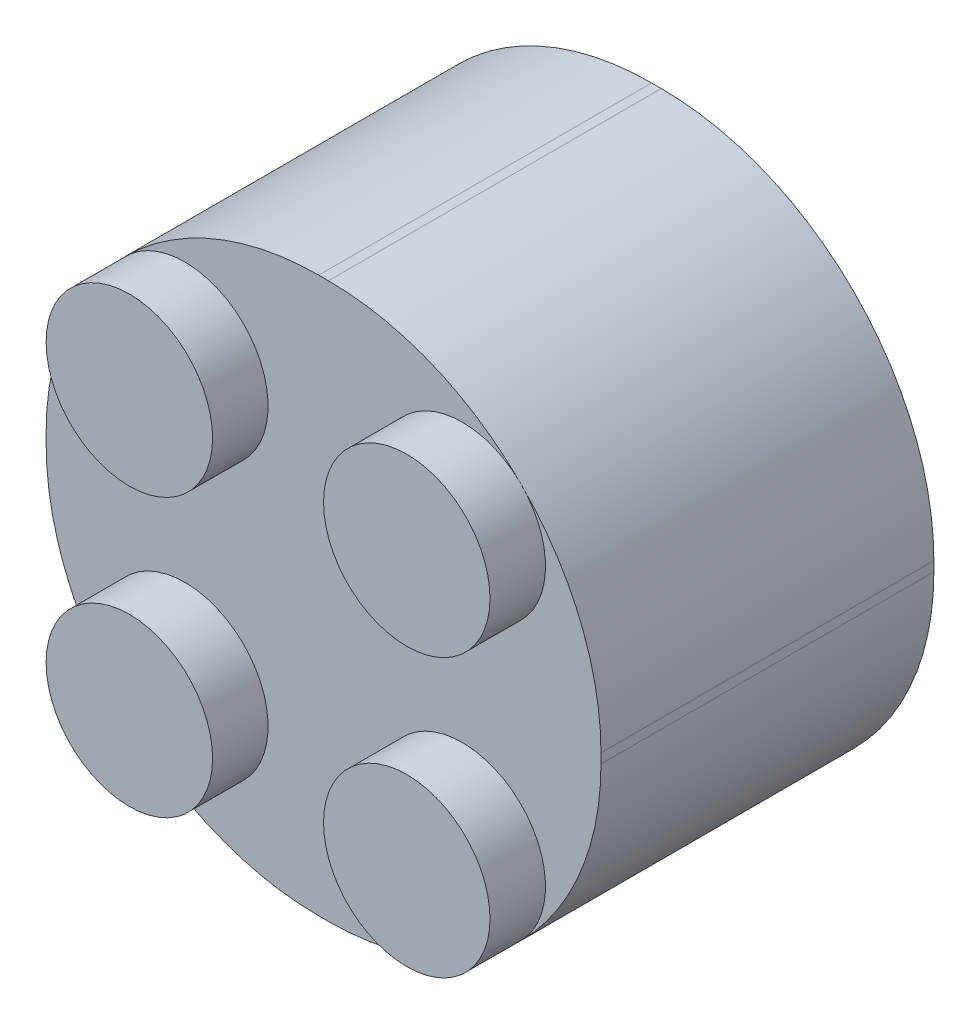
from build123d import *

# Parameters (mm, degrees)
SKETCH1_W            = 16
SKETCH1_H            = 16
BOSS_EXTRUDE1_DEPTH  = 9.6
SKETCH2_R            = 2.4
BOSS_EXTRUDE2_DEPTH  = 1.6
LPATTERN1_COUNT      = 2
LPATTERN1_PITCH      = 8
LPATTERN1_COUNT_DIR2 = 2
LPATTERN1_PITCH_DIR2 = 8
FILLET1_R            = 7.86
SHELL1_T             = -1.6
SKETCH3_R            = 3.256
SKETCH3_R_2          = 2.4
BOSS_EXTRUDE3_DEPTH  = 8


with BuildPart() as part:
    # Sketch1 → Boss-Extrude1 (new body)
    with BuildSketch(Plane.XY):
        with Locations((8, 8)):
            Rectangle(SKETCH1_W, SKETCH1_H)
    extrude(amount=BOSS_EXTRUDE1_DEPTH)

    # Sketch2 → Boss-Extrude2 (add)
    with BuildSketch(Plane.XY.offset(9.6)):
        with Locations(Location((4, 12, 0), (0, 0, 180))):
            Circle(SKETCH2_R)
    boss_extrude2 = extrude(amount=BOSS_EXTRUDE2_DEPTH)

    # LPattern1: Boss-Extrude2 2 × 2
    with Locations(*[(i * LPATTERN1_PITCH, -j * LPATTERN1_PITCH_DIR2, 0) for i in range(LPATTERN1_COUNT) for j in range(LPATTERN1_COUNT_DIR2) if (i, j) != (0, 0)]):
        add(boss_extrude2)

    # Fillet1
    fillet1_edges = [part.edges().sort_by_distance(p)[0] for p in [
        (0, 16, 4.8),
        (16, 16, 4.8),
        (16, 0, 4.8),
        (0, 0, 4.8),
    ]]
    fillet(fillet1_edges, radius=FILLET1_R)

    # Shell1
    shell1_openings = [part.faces().sort_by_distance(p)[0] for p in [
        (8, 8, 0),
    ]]
    offset(amount=SHELL1_T, openings=shell1_openings, kind=Kind.INTERSECTION)

    # Sketch3 → Boss-Extrude3 (add)
    with BuildSketch(Plane(origin=(0, 0, 8), x_dir=(-1, 0, 0), z_dir=(0, 0, -1))):
        with Locations((-8, 7.999999999)):
            Circle(SKETCH3_R)
        with Locations((-8, 7.999999999)):
            Circle(SKETCH3_R_2, mode=Mode.SUBTRACT)
    extrude(amount=BOSS_EXTRUDE3_DEPTH)


solid = part.part
